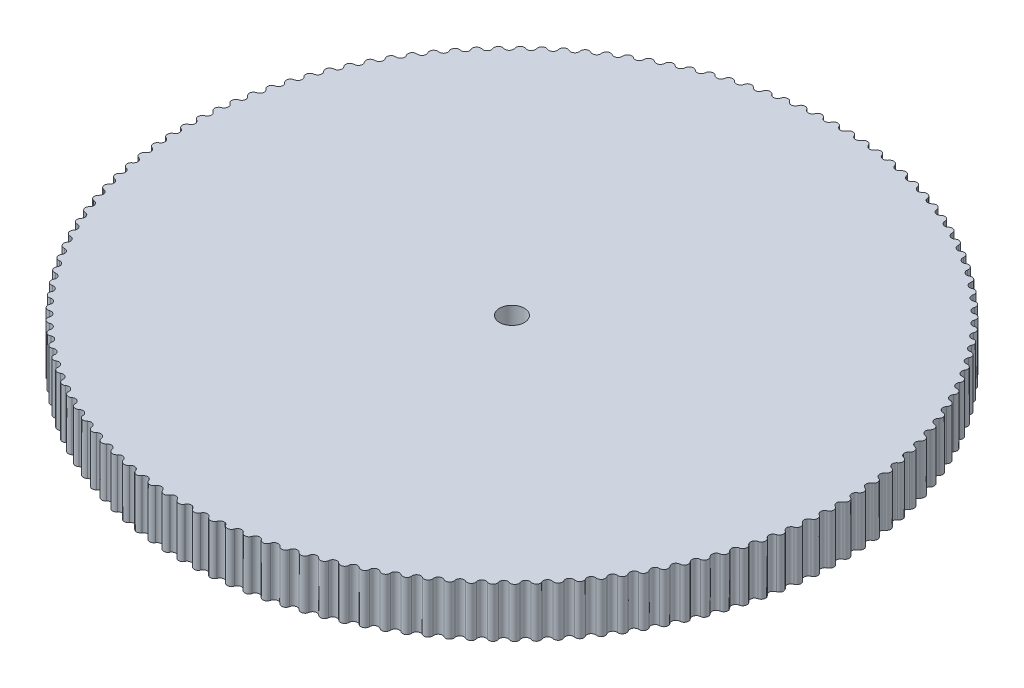
from build123d import *

# Parameters (mm, degrees)
BOSS_EXTRUDE1_DEPTH = 20
CIRPATTERN1_COUNT   = 133


with BuildPart() as part:
    # Sketch1 → Boss-Extrude1 (new body)
    with BuildSketch(Plane(origin=(0, 0, 0), x_dir=(1, 0, 0), z_dir=(0, 1, 0))):
        with BuildLine():
            Line((0, 132), (0, 5))
            ThreePointArc((0, 5), (0.118094004, 4.998605186), (0.236122121, 4.994421522))
            Line((0.236122121, 4.994421522), (6.233624002, 131.852728192))
            ThreePointArc((6.233624002, 131.852728192), (4.711403061, 132.916525237), (3.117681718, 131.963176912))
            ThreePointArc((3.117681718, 131.963176912), (1.547139361, 130.99086365), (0, 132))
        make_face()
    boss_extrude1 = extrude(amount=BOSS_EXTRUDE1_DEPTH)

    # CirPattern1: Boss-Extrude1 ×133 about axis
    cirpattern1_axis = Axis((0, 0, 0), (0, 1, 0))
    for i in range(1, CIRPATTERN1_COUNT):
        add(boss_extrude1.rotate(cirpattern1_axis, i * 360 / CIRPATTERN1_COUNT))


solid = part.part
